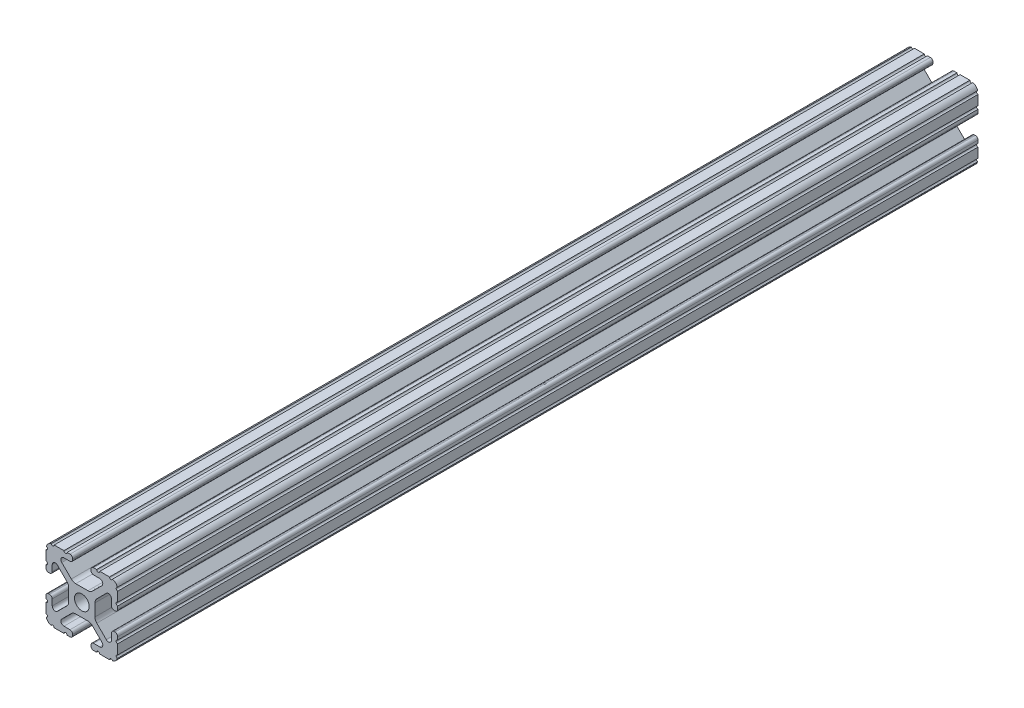
from build123d import *

# Parameters (mm, degrees)
BOSS_EXTRUDE1_DEPTH     = 152.4
CUT_EXTRUDE1_DEPTH      = 154.454683865
CUT_EXTRUDE1_DEPTH_BACK = 154.454683865
SKETCH5_R               = 0.55245
SKETCH6_R               = 3.2639
CUT_EXTRUDE2_DEPTH      = 156.02325632


with BuildPart() as part:
    # Sketch4 → Boss-Extrude1 (new, symmetric)
    with BuildSketch(Plane.XY):
        with BuildLine():
            Line((4.190365, -12.7), (10.11729625, -12.7))
            ThreePointArc((10.11729625, -12.7), (11.943543585, -11.943543585), (12.7, -10.11729625))
            Line((12.7, -10.11729625), (12.7, -4.190365))
            ThreePointArc((12.7, -4.190365), (12.42492494, -3.52627506), (11.760835, -3.2512))
            Line((11.760835, -3.2512), (11.429365, -3.2512))
            ThreePointArc((11.429365, -3.2512), (10.76527506, -3.52627506), (10.4902, -4.190365))
            Line((10.4902, -4.190365), (10.4902, -6.348478019))
            ThreePointArc((10.4902, -6.348478019), (9.830707141, -7.335478831), (8.666460301, -7.103895736))
            Line((8.666460301, -7.103895736), (5.299899128, -3.737334563))
            ThreePointArc((5.299899128, -3.737334563), (4.817571085, -3.015479634), (4.6482, -2.16399369))
            Line((4.6482, -2.16399369), (4.6482, 0))
            Line((4.6482, 0), (2.6035, 0))
            ThreePointArc((2.6035, 0), (1.840952505, -1.840952505), (0, -2.6035))
            Line((0, -2.6035), (0, -4.6482))
            Line((0, -4.6482), (2.16399369, -4.6482))
            ThreePointArc((2.16399369, -4.6482), (3.015479634, -4.817571085), (3.737334563, -5.299899128))
            Line((3.737334563, -5.299899128), (7.103895736, -8.666460301))
            ThreePointArc((7.103895736, -8.666460301), (7.335478831, -9.830707141), (6.348478019, -10.4902))
            Line((6.348478019, -10.4902), (4.190365, -10.4902))
            ThreePointArc((4.190365, -10.4902), (3.52627506, -10.76527506), (3.2512, -11.429365))
            Line((3.2512, -11.429365), (3.2512, -11.760835))
            ThreePointArc((3.2512, -11.760835), (3.52627506, -12.42492494), (4.190365, -12.7))
        make_face()
    extrude(amount=BOSS_EXTRUDE1_DEPTH, both=True)

    # Sketch5 → Cut-Extrude1 (cut, two sides: drawn at the far end of the back side and taken through both)
    with BuildSketch(Plane.XY.offset(-CUT_EXTRUDE1_DEPTH_BACK)):
        with Locations((10.356153152, -12.7)):
            Circle(SKETCH5_R)
        with Locations((5.796028019, -12.7)):
            Circle(SKETCH5_R)
        with Locations((12.7, -10.356153152)):
            Circle(SKETCH5_R)
        with Locations((12.7, -5.796028019)):
            Circle(SKETCH5_R)
    extrude(amount=CUT_EXTRUDE1_DEPTH + CUT_EXTRUDE1_DEPTH_BACK, mode=Mode.SUBTRACT)

    # Mirror1: part across plane


with BuildPart() as part_1:
    add(part.part)
    add(part.part.mirror(Plane(origin=(0, 0, 0), x_dir=(0, 0, 1), z_dir=(1, 0, 0))))

    # Mirror2: part across plane


with BuildPart() as part_2:
    add(part_1.part)
    add(part_1.part.mirror(Plane.ZX))

    # Sketch6 → Cut-Extrude2 (cut, through all)
    with BuildSketch(Plane(origin=(12.7, 0, 0), x_dir=(0, 0, -1), z_dir=(1, 0, 0))):
        with Locations(Location((0, 0, 0), (0, 0, 318.470270479))):
            Circle(SKETCH6_R)
    extrude(amount=-CUT_EXTRUDE2_DEPTH, mode=Mode.SUBTRACT)


solid = part_2.part
